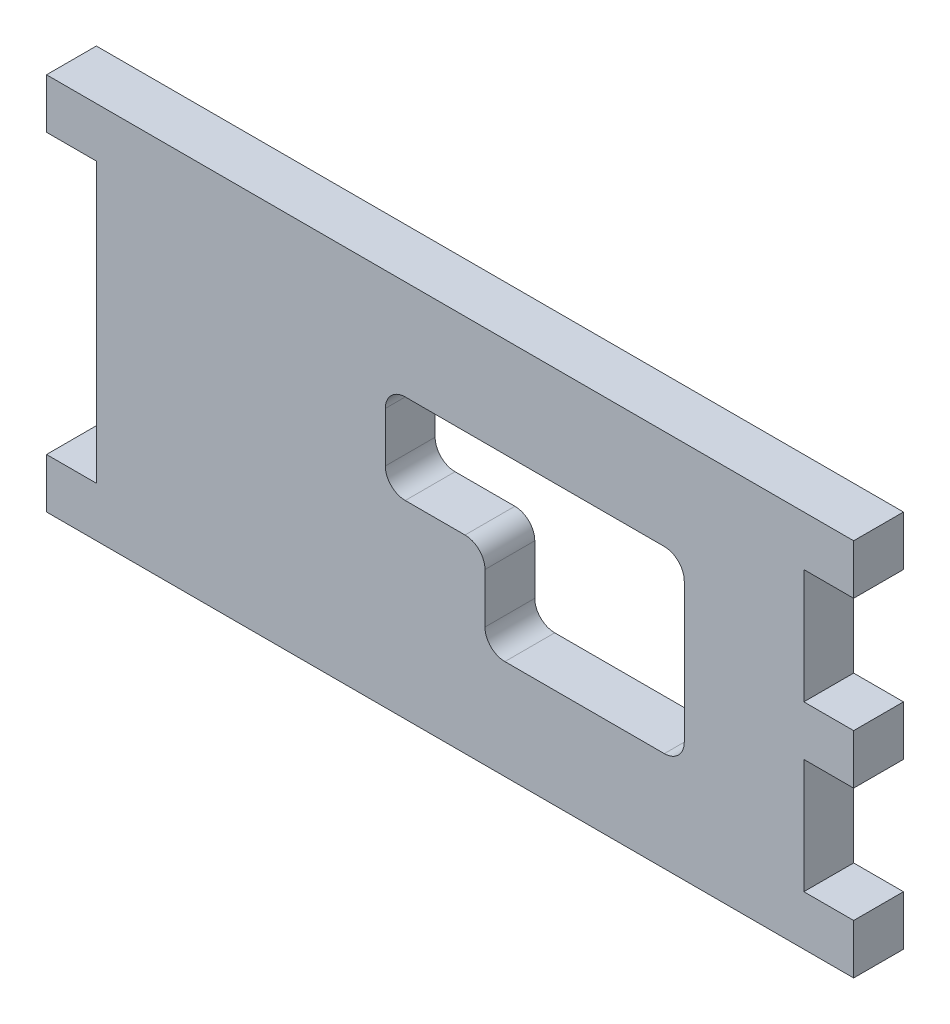
from build123d import *

# Parameters (mm, degrees)
BOSS_EXTRU_1_DEPTH = 5
CONG_1_R           = 2


with BuildPart() as part:
    # Esquisse1 → Boss.-Extru.1 (new body)
    with BuildSketch(Plane.XY):
        Polygon((0, 0), (71, 0), (76, 0), (76, 5), (71, 5), (71, 16.5), (76, 16.5), (76, 21.5), (71, 21.5), (71, 33), (76, 33), (76, 38), (71, 38), (0, 38), (-5, 38), (-5, 33), (0, 33), (0, 5), (-5, 5), (-5, 0), align=None)
        Polygon((39, 28), (59, 28), (59, 10), (39, 10), (39, 19), (29, 19), (29, 28), align=None, mode=Mode.SUBTRACT)
    extrude(amount=BOSS_EXTRU_1_DEPTH)

    # Congé1
    cong_1_edges = [part.edges().sort_by_distance(p)[0] for p in [
        (29, 28, 2.5),
        (29, 19, 2.5),
        (39, 19, 2.5),
        (39, 10, 2.5),
        (59, 10, 2.5),
        (59, 28, 2.5),
    ]]
    fillet(cong_1_edges, radius=CONG_1_R)


solid = part.part
